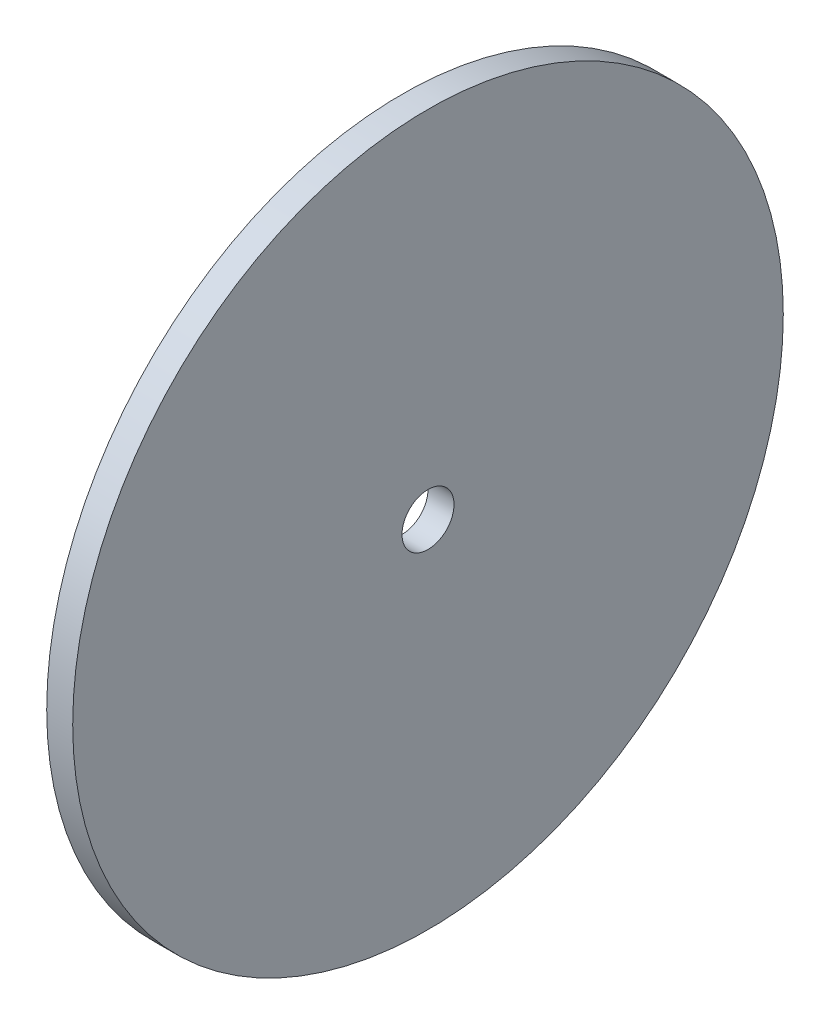
from build123d import *

# Parameters (mm, degrees)
SKETCH1_R           = 20.5
SKETCH1_R_2         = 1.5
BOSS_EXTRUDE1_DEPTH = 1.5


with BuildPart() as part:
    # Sketch1 → Boss-Extrude1 (new body)
    with BuildSketch(Plane(origin=(0, 0, 0), x_dir=(0, 0, -1), z_dir=(1, 0, 0))):
        Circle(SKETCH1_R)
        Circle(SKETCH1_R_2, mode=Mode.SUBTRACT)
    extrude(amount=BOSS_EXTRUDE1_DEPTH)


solid = part.part
